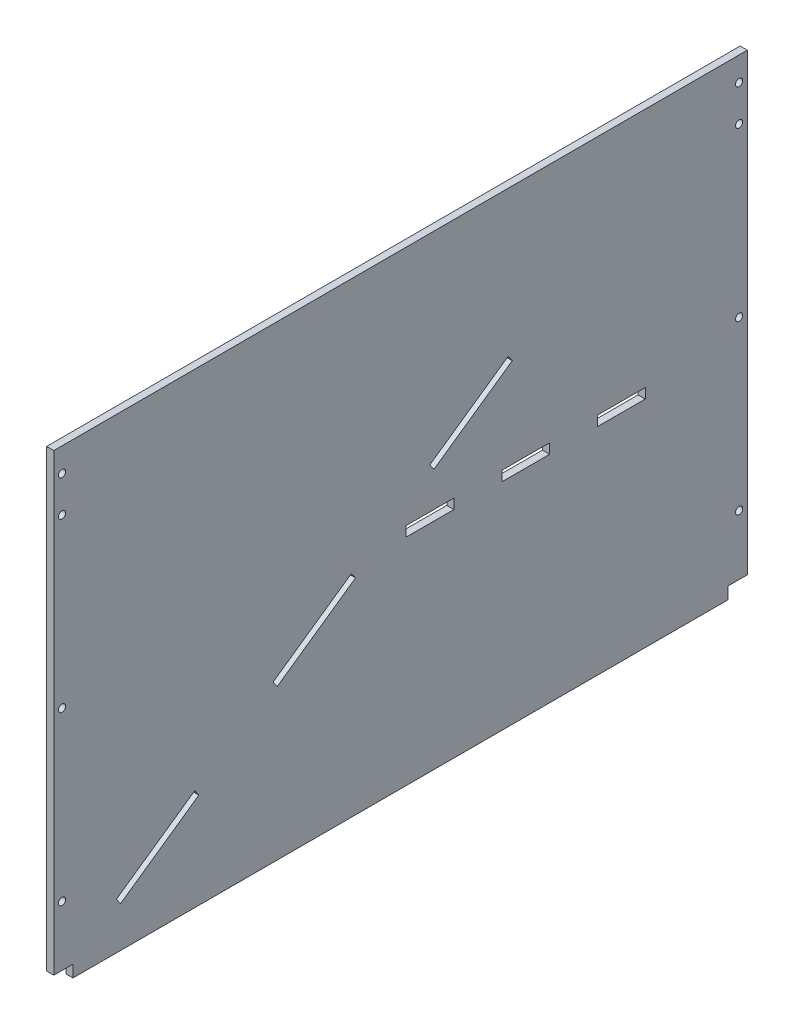
from build123d import *

# Parameters (mm, degrees)
SKETCH1_W           = 290
SKETCH1_H           = 195
BOSS_EXTRUDE1_DEPTH = 3
CUT_EXTRUDE1_DEPTH  = 10
SKETCH3_R           = 1.5
CUT_EXTRUDE2_DEPTH  = 10
CUT_EXTRUDE3_DEPTH  = 10
SKETCH5_W           = 20
SKETCH5_H           = 4.158505531
CUT_EXTRUDE4_DEPTH  = 10


with BuildPart() as part:
    # Sketch1 → Boss-Extrude1 (new body)
    with BuildSketch(Plane(origin=(0, 0, 0), x_dir=(0, 0, -1), z_dir=(1, 0, 0))):
        with Locations((-4.5, 3.341494469)):
            Rectangle(SKETCH1_W, SKETCH1_H)
    extrude(amount=BOSS_EXTRUDE1_DEPTH)

    # Sketch2 → Cut-Extrude1 (cut)
    with BuildSketch(Plane(origin=(3, 0, 0), x_dir=(0, 0, -1), z_dir=(1, 0, 0))):
        Polygon((-141.5, -94.158505531), (-141.5, -89.158505531), (-159.427644911, -89.158505531), (-159.427644911, -110.995569774), (-141.5, -110.995569774), align=None)
        Polygon((132.5, -110.995569774), (132.5, -94.158505531), (132.5, -89.158505531), (150.427644911, -89.158505531), (150.427644911, -110.995569774), align=None)
    extrude(amount=-CUT_EXTRUDE1_DEPTH, mode=Mode.SUBTRACT)

    # Sketch3 → Cut-Extrude2 (cut)
    with BuildSketch(Plane.ZY):
        with Locations((146.066251174, -64.158505531)):
            Circle(SKETCH3_R)
        with Locations((-137.061834429, -64.158505531)):
            Circle(SKETCH3_R)
        with Locations((-137.061834429, 5.841494469)):
            Circle(SKETCH3_R)
        with Locations((146.066251174, 5.841494469)):
            Circle(SKETCH3_R)
        with Locations((-137.061834429, 75.841494469)):
            Circle(SKETCH3_R)
        with Locations((146.066251174, 75.841494469)):
            Circle(SKETCH3_R)
        with Locations((-137.061834429, 90.841494469)):
            Circle(SKETCH3_R)
        with Locations((146.066251174, 90.841494469)):
            Circle(SKETCH3_R)
    extrude(amount=-CUT_EXTRUDE2_DEPTH, mode=Mode.SUBTRACT)

    # Sketch4 → Cut-Extrude3 (cut)
    with BuildSketch(Plane(origin=(3, 0, 0), x_dir=(0, 0, -1), z_dir=(1, 0, 0))):
        Polygon((-123.337688423, -74.726407598), (-90.571606652, -51.783350144), (-88.850877343, -54.240806276), (-121.616959114, -77.18386373), align=None)
        Polygon((-57.80552488, -28.84029269), (-25.039443109, -5.897235235), (-23.3187138, -8.354691368), (-56.084795571, -31.297748822), align=None)
        Polygon((7.726638663, 17.045822219), (40.492720435, 39.988879673), (42.213449744, 37.53142354), (9.447367972, 14.588366086), align=None)
    extrude(amount=-CUT_EXTRUDE3_DEPTH, mode=Mode.SUBTRACT)

    # Sketch5 → Cut-Extrude4 (cut)
    with BuildSketch(Plane(origin=(3, 0, 0), x_dir=(0, 0, -1), z_dir=(1, 0, 0))):
        with Locations((7.816456388, -2.079252766)):
            Rectangle(SKETCH5_W, SKETCH5_H)
        with Locations((47.816456388, -2.079252766)):
            Rectangle(SKETCH5_W, SKETCH5_H)
        with Locations((87.816456388, -2.079252766)):
            Rectangle(SKETCH5_W, SKETCH5_H)
    extrude(amount=-CUT_EXTRUDE4_DEPTH, mode=Mode.SUBTRACT)


solid = part.part
